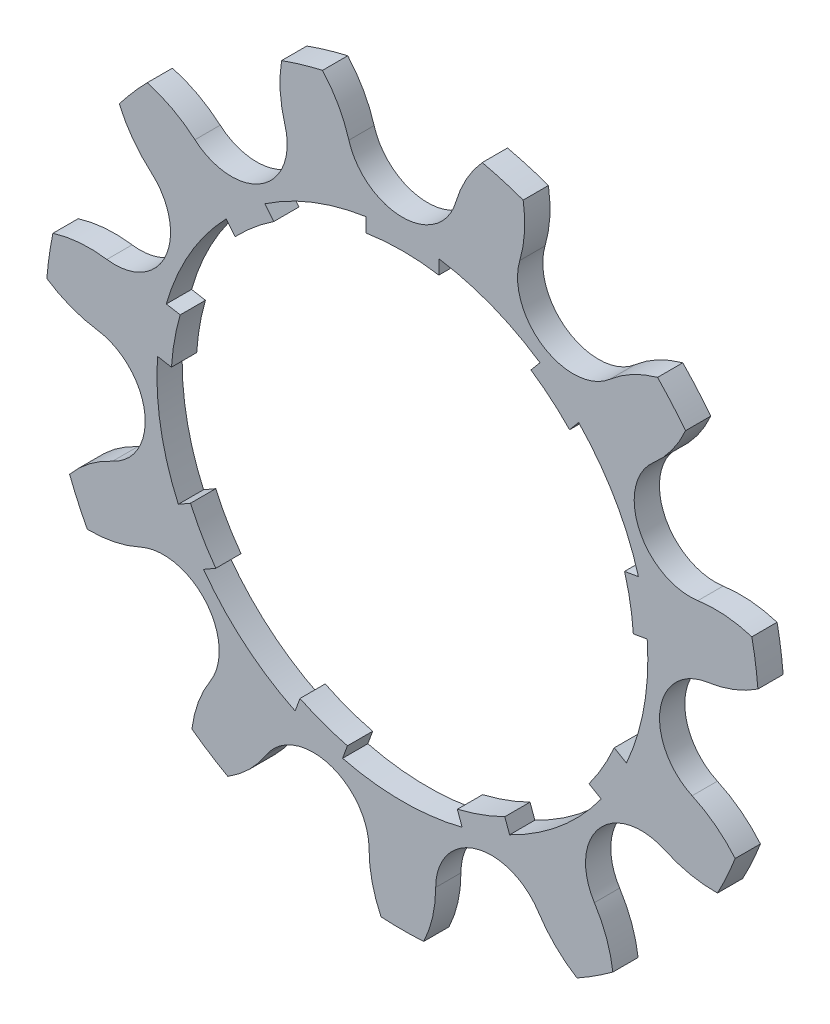
from build123d import *

# Parameters (mm, degrees)
SK_DISCO_R           = 25.436113967
DISCO_DEPTH          = 1.8
HUECO_DIENTE_DEPTH   = 37.017104096
MATRIZ_DIENTES_COUNT = 11


with BuildPart() as part:
    # Sk_Disco → Disco (new body)
    with BuildSketch(Plane.XY):
        Circle(SK_DISCO_R)
        with BuildLine():
            Line((2.6, 17.305779381), (2.6, 16.293863876))
            ThreePointArc((2.6, 16.293863876), (0, 16.5), (-2.6, 16.293863876))
            Line((-2.6, 16.293863876), (-2.6, 17.305779381))
            ThreePointArc((-2.6, 17.305779381), (-6.362648192, 16.302352836), (-9.810241185, 14.491693065))
            Line((-9.810241185, 14.491693065), (-9.163816615, 13.721314261))
            ThreePointArc((-9.163816615, 13.721314261), (-10.60599556, 12.639733311), (-11.92157661, 11.407278866))
            Line((-11.92157661, 11.407278866), (-12.56800118, 12.17765767))
            ThreePointArc((-12.56800118, 12.17765767), (-15.155444566, 8.75), (-16.830161491, 4.795379462))
            Line((-16.830161491, 4.795379462), (-15.839781591, 4.620748764))
            ThreePointArc((-15.839781591, 4.620748764), (-16.249327925, 2.865194932), (-16.464915031, 1.075440854))
            Line((-16.464915031, 1.075440854), (-17.455294931, 1.250071551))
            ThreePointArc((-17.455294931, 1.250071551), (-17.234135678, -3.038843109), (-15.975062189, -7.144745486))
            Line((-15.975062189, -7.144745486), (-15.104136721, -6.641916433))
            ThreePointArc((-15.104136721, -6.641916433), (-14.289419162, -8.25), (-13.304136721, -9.759607887))
            Line((-13.304136721, -9.759607887), (-14.175062189, -10.26243694))
            ThreePointArc((-14.175062189, -10.26243694), (-11.24878317, -13.405777755), (-7.645053746, -15.741764616))
            Line((-7.645053746, -15.741764616), (-7.301098416, -14.796755115))
            ThreePointArc((-7.301098416, -14.796755115), (-5.643332365, -15.504928243), (-3.918204981, -16.028027631))
            Line((-3.918204981, -16.028027631), (-4.262160311, -16.973037132))
            ThreePointArc((-4.262160311, -16.973037132), (0, -17.5), (4.262160311, -16.973037132))
            Line((4.262160311, -16.973037132), (3.918204981, -16.028027631))
            ThreePointArc((3.918204981, -16.028027631), (5.643332365, -15.504928243), (7.301098416, -14.796755115))
            Line((7.301098416, -14.796755115), (7.645053746, -15.741764616))
            ThreePointArc((7.645053746, -15.741764616), (11.24878317, -13.405777755), (14.175062189, -10.26243694))
            Line((14.175062189, -10.26243694), (13.304136721, -9.759607887))
            ThreePointArc((13.304136721, -9.759607887), (14.289419162, -8.25), (15.104136721, -6.641916433))
            Line((15.104136721, -6.641916433), (15.975062189, -7.144745486))
            ThreePointArc((15.975062189, -7.144745486), (17.234135678, -3.038843109), (17.455294931, 1.250071551))
            Line((17.455294931, 1.250071551), (16.464915031, 1.075440854))
            ThreePointArc((16.464915031, 1.075440854), (16.249327925, 2.865194932), (15.839781591, 4.620748764))
            Line((15.839781591, 4.620748764), (16.830161491, 4.795379462))
            ThreePointArc((16.830161491, 4.795379462), (15.155444566, 8.75), (12.56800118, 12.17765767))
            Line((12.56800118, 12.17765767), (11.92157661, 11.407278866))
            ThreePointArc((11.92157661, 11.407278866), (10.60599556, 12.639733311), (9.163816615, 13.721314261))
            Line((9.163816615, 13.721314261), (9.810241185, 14.491693065))
            ThreePointArc((9.810241185, 14.491693065), (6.362648192, 16.302352836), (2.6, 17.305779381))
        make_face(mode=Mode.SUBTRACT)
    extrude(amount=DISCO_DEPTH)

    # Sk_Hueco → Hueco_diente (cut, through all)
    with BuildSketch(Plane.XY):
        with BuildLine():
            ThreePointArc((-3.81398457, 21.41921922), (0, 18.564106134), (3.81398457, 21.41921922))
            ThreePointArc((3.81398457, 21.41921922), (5.23928173, 24.240764826), (7.576378688, 26.369278253))
            ThreePointArc((7.576378688, 26.369278253), (0, 27.436113967), (-7.576378688, 26.369278253))
            ThreePointArc((-7.576378688, 26.369278253), (-5.23928173, 24.240764826), (-3.81398457, 21.41921922))
        make_face()
    hueco_diente = extrude(amount=HUECO_DIENTE_DEPTH, mode=Mode.SUBTRACT)

    # Matriz_dientes: Hueco_diente ×11 about axis
    matriz_dientes_axis = Axis((0, 0, -0.09), (0, 0, 1))
    for i in range(1, MATRIZ_DIENTES_COUNT):
        add(hueco_diente.rotate(matriz_dientes_axis, i * 360 / MATRIZ_DIENTES_COUNT), mode=Mode.SUBTRACT)


solid = part.part
